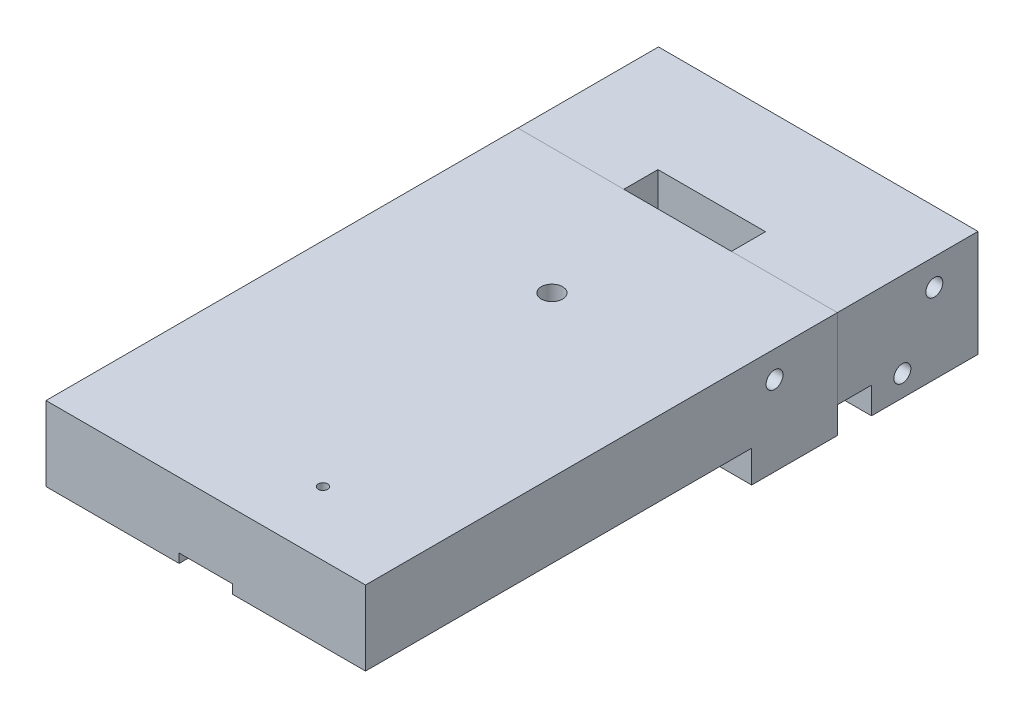
from build123d import *

# Parameters (mm, degrees)
BOSS_EXTRUDE1_DEPTH         = 12.7
BOSS_EXTRUDE1_DEPTH_BACK    = 12.7
SKETCH1_W                   = 76.2
SKETCH1_H                   = 146.05
SKETCH2_R                   = 4.7625
CUT_EXTRUDE1_DEPTH          = 25.4
CUT_EXTRUDE2_DEPTH          = 7.62
CUT_EXTRUDE4_DEPTH          = 84.339970152
CUT_EXTRUDE4_DEPTH_BACK     = 84.339970152
SKETCH5_W                   = 25.654
SKETCH5_H                   = 8.128
F_1_4_20_TAPPED_HOLE1_D     = 5.1054
F_1_4_20_TAPPED_HOLE1_DEPTH = 19.05
F_1_4_20_TAPPED_HOLE1_TIP   = 1.533816902
SKETCH9_R                   = 1.59639
F_8_32_TAPPED_HOLE_DEPTH    = 12.7
CUT_EXTRUDE7_DEPTH          = 85.263806139
CUT_EXTRUDE7_DEPTH_BACK     = 2.159
CUT_EXTRUDE8_DEPTH          = 85.263806139
CUT_EXTRUDE8_DEPTH_BACK     = 12.7
SKETCH12_R                  = 2.0193
SKETCH13_W                  = 25.273
SKETCH13_H                  = 8.128
CUT_EXTRUDE9_DEPTH          = 6.35
SKETCH15_R                  = 2.0193
CUT_EXTRUDE11_DEPTH         = 57.15
SKETCH17_R                  = 4.2164
CUT_EXTRUDE12_DEPTH         = 5.461
SKETCH19_R                  = 2.0193
CUT_EXTRUDE14_DEPTH         = 12.7
CUT_EXTRUDE16_DEPTH         = 2.286
CUT_EXTRUDE18_DEPTH         = 11.176
F_10_32_TAPPED_HOLE1_D      = 4.0386
F_10_32_TAPPED_HOLE1_DEPTH  = 14.1224
F_10_32_TAPPED_HOLE1_TIP    = 1.213317848
SKETCH31_W                  = 76.2
SKETCH31_H                  = 53.975
CUT_EXTRUDE20_DEPTH         = 7.62
F_4_40_TAPPED_HOLE1_D       = 2.2606
F_8_32_TAPPED_HOLE1_D       = 3.4544
F_8_32_TAPPED_HOLE1_DEPTH   = 12.7
F_8_32_TAPPED_HOLE1_TIP     = 1.037806461


with BuildPart() as part:
    # Sketch1 → Boss-Extrude1 (new, two sides: drawn at the far end of the back side and taken through both)
    with BuildSketch(Plane(origin=(0, 0, 0), x_dir=(1, 0, 0), z_dir=(0, 1, 0)).offset(-BOSS_EXTRUDE1_DEPTH_BACK)):
        Rectangle(SKETCH1_W, SKETCH1_H)
    extrude(amount=BOSS_EXTRUDE1_DEPTH + BOSS_EXTRUDE1_DEPTH_BACK)

    # Sketch2 → Cut-Extrude1 (cut)
    with BuildSketch(Plane(origin=(0, 0, -73.025), x_dir=(-1, 0, 0), z_dir=(0, 0, -1))):
        with Locations((0, -12.7)):
            Circle(SKETCH2_R)
    extrude(amount=-CUT_EXTRUDE1_DEPTH, mode=Mode.SUBTRACT)

    # Sketch3 → Cut-Extrude2 (cut)
    with BuildSketch(Plane(origin=(0, -12.7, 0), x_dir=(-1, 0, 0), z_dir=(0, -1, 0))):
        Polygon((10.922, 19.05), (38.1, 19.05), (38.1, -19.05), (31.75, -19.05), (-31.75, -19.05), (-38.1, -19.05), (-38.1, 19.05), (-10.922, 19.05), (-10.922, 39.497), (10.922, 39.497), align=None)
    extrude(amount=-CUT_EXTRUDE2_DEPTH, mode=Mode.SUBTRACT)

    # Sketch5 → Cut-Extrude4 (cut, two sides: drawn at the far end of the back side and taken through both)
    with BuildSketch(Plane(origin=(0, 0, 0), x_dir=(1, 0, 0), z_dir=(0, 1, 0)).offset(-CUT_EXTRUDE4_DEPTH_BACK)):
        with Locations((0, 43.561)):
            Rectangle(SKETCH5_W, SKETCH5_H)
    extrude(amount=CUT_EXTRUDE4_DEPTH + CUT_EXTRUDE4_DEPTH_BACK, mode=Mode.SUBTRACT)

    # 1/4-20 Tapped Hole1
    with Locations(Plane(origin=(-11.034450397, 12.7, 14.547513529), x_dir=(-1, 0, 0), z_dir=(0, 1, 0))):
        with Locations((-11.034450397, -24.072513529)):
            Hole(F_1_4_20_TAPPED_HOLE1_D / 2, depth=F_1_4_20_TAPPED_HOLE1_DEPTH)
            with Locations((0, 0, -(F_1_4_20_TAPPED_HOLE1_DEPTH + F_1_4_20_TAPPED_HOLE1_TIP / 2))):  # 118° drill point
                Cone(0, F_1_4_20_TAPPED_HOLE1_D / 2, F_1_4_20_TAPPED_HOLE1_TIP, mode=Mode.SUBTRACT)

    # Sketch9 → 8-32 Tapped Hole (cut)
    with BuildSketch(Plane(origin=(0, -12.7, 0), x_dir=(-1, 0, 0), z_dir=(0, -1, 0))):
        with Locations(Location((31.75, 28.575, 0), (0, 0, 90))):
            Circle(SKETCH9_R)
        with Locations(Location((31.75, -28.575, 0), (0, 0, 90))):
            Circle(SKETCH9_R)
        with Locations(Location((-31.75, -28.575, 0), (0, 0, 270))):
            Circle(SKETCH9_R)
        with Locations(Location((-31.75, 28.575, 0), (0, 0, 270))):
            Circle(SKETCH9_R)
    extrude(amount=-F_8_32_TAPPED_HOLE_DEPTH, mode=Mode.SUBTRACT)

    # Sketch11 → Cut-Extrude7 (cut, two sides: drawn at the far end of the back side and taken through both)
    with BuildSketch(Plane(origin=(0, -5.08, 0), x_dir=(-1, 0, 0), z_dir=(0, -1, 0)).offset(-CUT_EXTRUDE7_DEPTH_BACK)):
        with BuildLine():
            Line((0.00254, -28.575), (-0.00254, -28.575))
            ThreePointArc((-0.00254, -28.575), (-4.490872009, -30.434127991), (-6.35, -34.92246))
            Line((-6.35, -34.92246), (-6.35, -73.025))
            Line((-6.35, -73.025), (6.35, -73.025))
            Line((6.35, -73.025), (6.35, -34.92246))
            ThreePointArc((6.35, -34.92246), (4.490872009, -30.434127991), (0.00254, -28.575))
        make_face()
    extrude(amount=CUT_EXTRUDE7_DEPTH + CUT_EXTRUDE7_DEPTH_BACK, mode=Mode.SUBTRACT)

    # Sketch12 → Cut-Extrude8 (cut, two sides: drawn at the far end of the back side and taken through both)
    with BuildSketch(Plane.XZ.offset(5.08).offset(-CUT_EXTRUDE8_DEPTH_BACK)):
        with Locations(Location((12.7, 66.675, 0), (0, 0, 90))):
            Circle(SKETCH12_R)
        with Locations(Location((-12.7, 66.675, 0), (0, 0, 90))):
            Circle(SKETCH12_R)
    extrude(amount=CUT_EXTRUDE8_DEPTH + CUT_EXTRUDE8_DEPTH_BACK, mode=Mode.SUBTRACT)

    # Sketch13 → Cut-Extrude9 (cut)
    with BuildSketch(Plane.XZ.offset(12.7)):
        with Locations((25.4635, -43.561)):
            Rectangle(SKETCH13_W, SKETCH13_H)
    extrude(amount=-CUT_EXTRUDE9_DEPTH, mode=Mode.SUBTRACT)

    # Sketch15 → Cut-Extrude11 (cut)
    with BuildSketch(Plane(origin=(0, 0, -73.025), x_dir=(-1, 0, 0), z_dir=(0, 0, -1))):
        with Locations((-24.13, 0)):
            Circle(SKETCH15_R)
        with Locations((24.13, 0)):
            Circle(SKETCH15_R)
    extrude(amount=-CUT_EXTRUDE11_DEPTH, mode=Mode.SUBTRACT)

    # Sketch17 → Cut-Extrude12 (cut)
    with BuildSketch(Plane(origin=(0, 0, -73.025), x_dir=(-1, 0, 0), z_dir=(0, 0, -1))):
        with Locations((-24.13, 0)):
            Circle(SKETCH17_R)
        with Locations((24.13, 0)):
            Circle(SKETCH17_R)
    extrude(amount=-CUT_EXTRUDE12_DEPTH, mode=Mode.SUBTRACT)

    # Sketch19 → Cut-Extrude14 (cut)
    with BuildSketch(Plane.XZ.offset(12.7)):
        with Locations(Location((-31.75, -57.15, 0), (0, 0, 270))):
            Circle(SKETCH19_R)
        with Locations(Location((12.7, -57.15, 0), (0, 0, 270))):
            Circle(SKETCH19_R)
    extrude(amount=-CUT_EXTRUDE14_DEPTH, mode=Mode.SUBTRACT)

    # Sketch22 → Cut-Extrude16 (cut)
    with BuildSketch(Plane.XZ.offset(12.7)):
        with BuildLine():
            Line((-12.7, -32.86125), (12.7, -32.86125))
            ThreePointArc((12.7, -32.86125), (13.49375, -32.0675), (12.7, -31.27375))
            Line((12.7, -31.27375), (-12.7, -31.27375))
            ThreePointArc((-12.7, -31.27375), (-13.49375, -32.0675), (-12.7, -32.86125))
        make_face()
        with BuildLine():
            Line((-12.7, -20.60575), (12.7, -20.60575))
            ThreePointArc((12.7, -20.60575), (13.49375, -21.3995), (12.7, -22.19325))
            Line((12.7, -22.19325), (-12.7, -22.19325))
            ThreePointArc((-12.7, -22.19325), (-13.49375, -21.3995), (-12.7, -20.60575))
        make_face()
    extrude(amount=-CUT_EXTRUDE16_DEPTH, mode=Mode.SUBTRACT)

    # Sketch23 → Cut-Extrude18 (cut)
    with BuildSketch(Plane.XZ.offset(12.7)):
        with BuildLine():
            Line((-10.922, -39.497), (10.922, -39.497))
            Line((10.922, -39.497), (10.922, -22.225))
            ThreePointArc((10.922, -22.225), (9.99206403, -19.97993597), (7.747, -19.05))
            Line((7.747, -19.05), (-7.747, -19.05))
            ThreePointArc((-7.747, -19.05), (-9.99206403, -19.97993597), (-10.922, -22.225))
            Line((-10.922, -22.225), (-10.922, -39.497))
        make_face()
    extrude(amount=-CUT_EXTRUDE18_DEPTH, mode=Mode.SUBTRACT)

    # #10-32 Tapped Hole1
    with Locations(Plane(origin=(38.1, 0, 0), x_dir=(0, 0, -1), z_dir=(1, 0, 0))):
        with Locations((62.611, 6.35), (54.991, -7.62), (24.511, 6.35)):
            Hole(F_10_32_TAPPED_HOLE1_D / 2, depth=F_10_32_TAPPED_HOLE1_DEPTH)
            with Locations((0, 0, -(F_10_32_TAPPED_HOLE1_DEPTH + F_10_32_TAPPED_HOLE1_TIP / 2))):  # 118° drill point
                Cone(0, F_10_32_TAPPED_HOLE1_D / 2, F_10_32_TAPPED_HOLE1_TIP, mode=Mode.SUBTRACT)

    # Sketch31 → Cut-Extrude20 (cut)
    with BuildSketch(Plane.XZ.offset(12.7)):
        with Locations((0, 46.0375)):
            Rectangle(SKETCH31_W, SKETCH31_H)
    extrude(amount=-CUT_EXTRUDE20_DEPTH, mode=Mode.SUBTRACT)

    # #4-40 Tapped Hole1 (through all)
    with Locations(Plane(origin=(12.7, -5.08, 57.785), x_dir=(0, 0, -1), z_dir=(0, -1, 0))):
        with Locations((0, 0)):
            Hole(F_4_40_TAPPED_HOLE1_D / 2)

    # #8-32 Tapped Hole1
    with Locations(Plane(origin=(0, -12.7, 0), x_dir=(-1, 0, 0), z_dir=(0, -1, 0))):
        with Locations((-12.7, 68.2625), (12.7, 68.2625)):
            Hole(F_8_32_TAPPED_HOLE1_D / 2, depth=F_8_32_TAPPED_HOLE1_DEPTH)
            with Locations((0, 0, -(F_8_32_TAPPED_HOLE1_DEPTH + F_8_32_TAPPED_HOLE1_TIP / 2))):  # 118° drill point
                Cone(0, F_8_32_TAPPED_HOLE1_D / 2, F_8_32_TAPPED_HOLE1_TIP, mode=Mode.SUBTRACT)


with BuildPart() as body_2:
    # Split1: the piece on the far side of the plane
    add(part.part)
    split(bisect_by=Plane(origin=(0, 0, -39.497), x_dir=(-1, 0, 0), z_dir=(0, 0, -1)), keep=Keep.BOTTOM)


with BuildPart() as part_1:
    add(part.part)

    # Split1
    split(bisect_by=Plane(origin=(0, 0, -39.497), x_dir=(-1, 0, 0), z_dir=(0, 0, -1)), keep=Keep.TOP)


solid = Compound([body_2.part, part_1.part])
